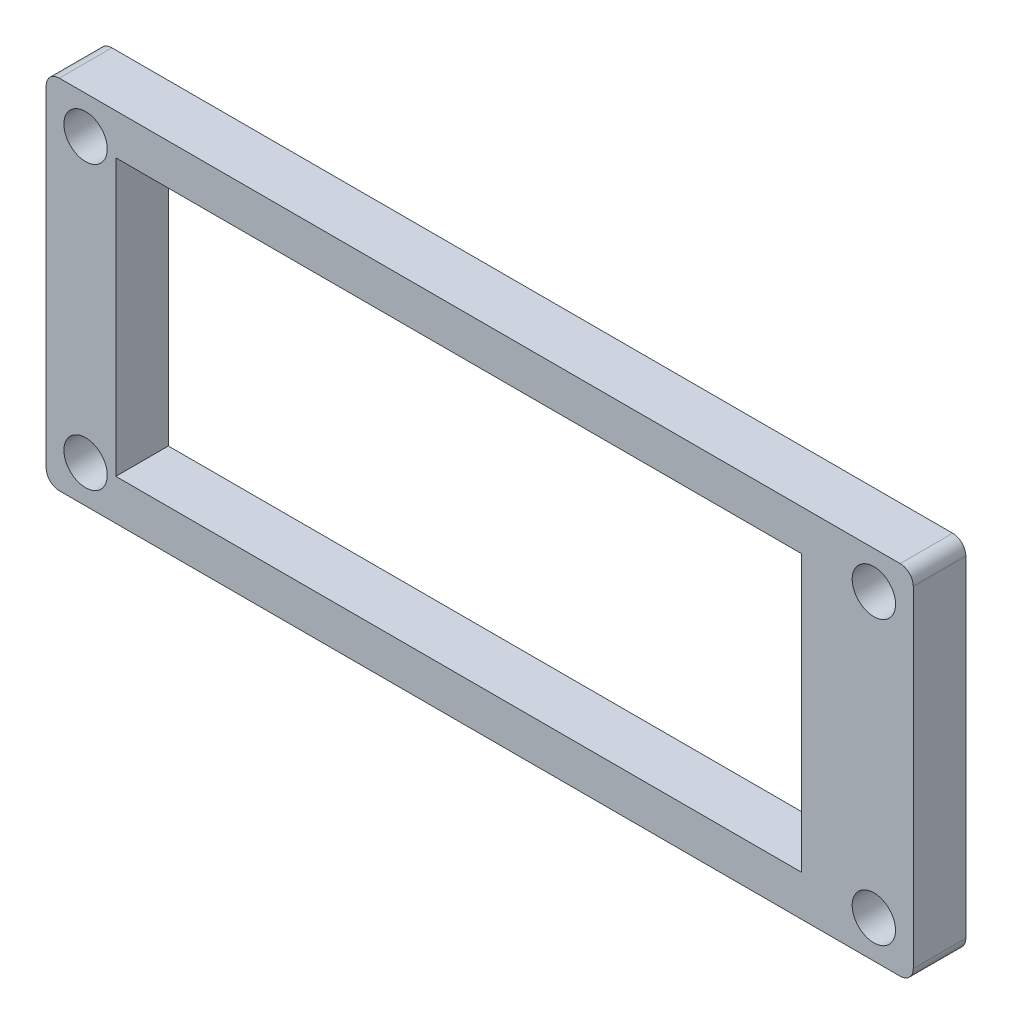
from build123d import *

# Parameters (mm, degrees)
SKETCH2_W           = 52.2
SKETCH2_H           = 21
SKETCH2_W_2         = 2.74
SKETCH2_H_2         = 10.36
BOSS_EXTRUDE1_DEPTH = 4
SKETCH2_3_W         = 2.74
SKETCH2_3_H         = 10.36
CUT_EXTRUDE1_DEPTH  = 3


with BuildPart() as part:
    # Sketch2 → Boss-Extrude1 (new body)
    # profile 1 of 3: a face of its own
    with BuildSketch(Plane.XY):
        with BuildLine():
            Line((34.6, 12.6), (34.6, -12.6))
            ThreePointArc((34.6, -12.6), (34.307106781, -13.307106781), (33.6, -13.6))
            Line((33.6, -13.6), (-30.4, -13.6))
            ThreePointArc((-30.4, -13.6), (-31.107106781, -13.307106781), (-31.4, -12.6))
            Line((-31.4, -12.6), (-31.4, 12.6))
            ThreePointArc((-31.4, 12.6), (-31.107106781, 13.307106781), (-30.4, 13.6))
            Line((-30.4, 13.6), (33.6, 13.6))
            ThreePointArc((33.6, 13.6), (34.307106781, 13.307106781), (34.6, 12.6))
        make_face()
        with BuildLine():
            ThreePointArc((-26.951988773, 9.958947861), (-27.608947861, 12.198011227), (-29.848011227, 11.541052139))
            ThreePointArc((-29.848011227, 11.541052139), (-29.191052139, 9.301988773), (-26.951988773, 9.958947861))
        make_face(mode=Mode.SUBTRACT)
        with BuildLine():
            ThreePointArc((-26.951988773, -11.541052139), (-27.608947861, -9.301988773), (-29.848011227, -9.958947861))
            ThreePointArc((-29.848011227, -9.958947861), (-29.191052139, -12.198011227), (-26.951988773, -11.541052139))
        make_face(mode=Mode.SUBTRACT)
        with BuildLine():
            ThreePointArc((33.048011227, -11.541052139), (32.391052139, -9.301988773), (30.151988773, -9.958947861))
            ThreePointArc((30.151988773, -9.958947861), (30.808947861, -12.198011227), (33.048011227, -11.541052139))
        make_face(mode=Mode.SUBTRACT)
        with BuildLine():
            ThreePointArc((33.048011227, 9.958947861), (32.391052139, 12.198011227), (30.151988773, 11.541052139))
            ThreePointArc((30.151988773, 11.541052139), (30.808947861, 9.301988773), (33.048011227, 9.958947861))
        make_face(mode=Mode.SUBTRACT)
        Rectangle(SKETCH2_W, SKETCH2_H, mode=Mode.SUBTRACT)
    # profile 2 of 3: a face of its own
    with BuildSketch(Plane.XY):
        with Locations((-28.4, -0.51)):
            Rectangle(SKETCH2_W_2, SKETCH2_H_2)
    # profile 3 of 3: a face of its own
    with BuildSketch(Plane.XY):
        with Locations((28.4, -0.51)):
            Rectangle(SKETCH2_W_2, SKETCH2_H_2)
    extrude(amount=BOSS_EXTRUDE1_DEPTH)

    # Sketch2<3> → Cut-Extrude1 (cut)
    with BuildSketch(Plane.XY):
        with Locations((-28.4, -0.51)):
            Rectangle(SKETCH2_3_W, SKETCH2_3_H)
        with Locations((28.4, -0.51)):
            Rectangle(SKETCH2_3_W, SKETCH2_3_H)
    extrude(amount=CUT_EXTRUDE1_DEPTH, mode=Mode.SUBTRACT)


solid = part.part
